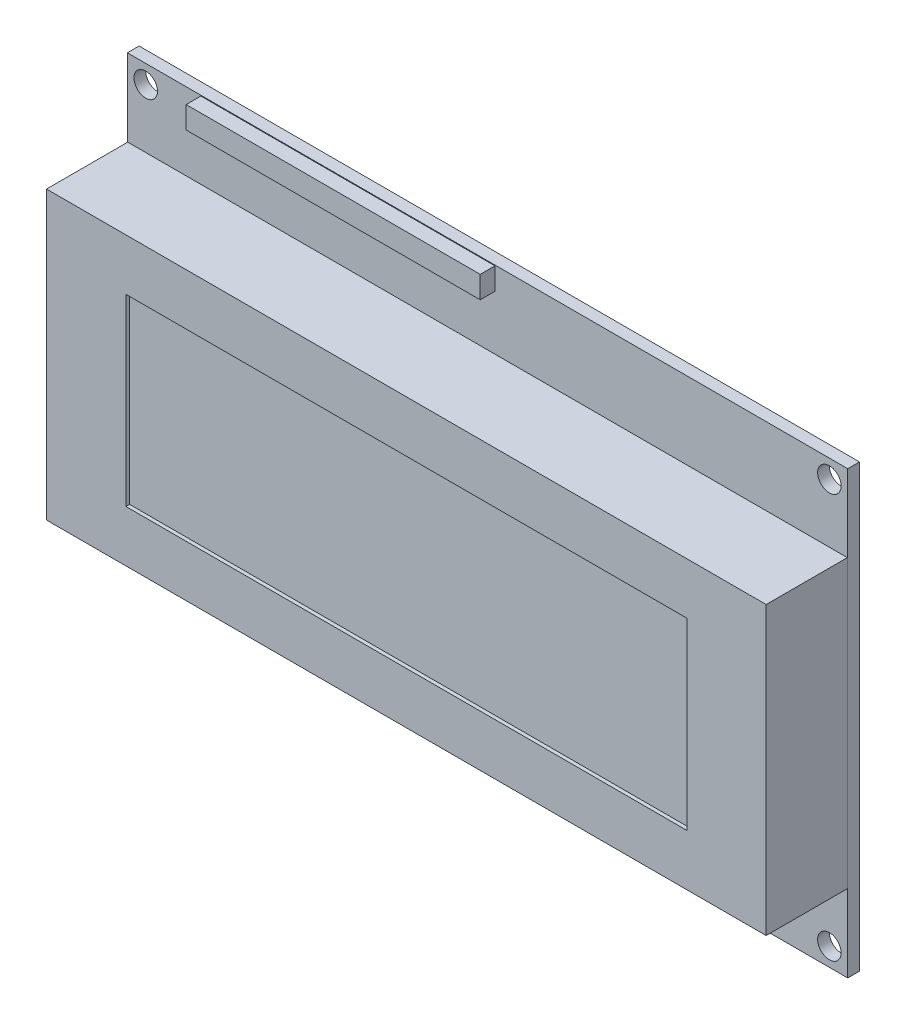
from build123d import *

# Parameters (mm, degrees)
ESQUISSE1_W             = 98
ESQUISSE1_H             = 60
BOSS_EXTRU_1_DEPTH      = 1.6
ESQUISSE2_R             = 1.6
ENL_V_MAT_EXTRU_1_DEPTH = 58.476603936
ESQUISSE3_W             = 97.9
ESQUISSE3_H             = 39
BOSS_EXTRU_2_DEPTH      = 11.05
ESQUISSE4_W             = 76.3
ESQUISSE4_H             = 25
ENL_V_MAT_EXTRU_2_DEPTH = 0.5
ESQUISSE5_W             = 40
ESQUISSE5_H             = 3
BOSS_EXTRU_3_DEPTH      = 2


with BuildPart() as part:
    # Esquisse1 → Boss.-Extru.1 (new body)
    with BuildSketch(Plane.XY):
        Rectangle(ESQUISSE1_W, ESQUISSE1_H)
    extrude(amount=BOSS_EXTRU_1_DEPTH)

    # Esquisse2 → Enlèv. mat.-Extru.1 (cut, through all)
    with BuildSketch(Plane.XY.offset(1.6)):
        with Locations((-46.5, 27.5)):
            Circle(ESQUISSE2_R)
        with Locations((-46.5, -27.5)):
            Circle(ESQUISSE2_R)
        with Locations((46.5, -27.5)):
            Circle(ESQUISSE2_R)
        with Locations((46.5, 27.5)):
            Circle(ESQUISSE2_R)
    extrude(amount=-ENL_V_MAT_EXTRU_1_DEPTH, mode=Mode.SUBTRACT)

    # Esquisse3 → Boss.-Extru.2 (add)
    with BuildSketch(Plane.XY.offset(1.6)):
        Rectangle(ESQUISSE3_W, ESQUISSE3_H)
    extrude(amount=BOSS_EXTRU_2_DEPTH)

    # Esquisse4 → Enlèv. mat.-Extru.2 (cut)
    with BuildSketch(Plane.XY.offset(12.65)):
        Rectangle(ESQUISSE4_W, ESQUISSE4_H)
    extrude(amount=-ENL_V_MAT_EXTRU_2_DEPTH, mode=Mode.SUBTRACT)

    # Esquisse5 → Boss.-Extru.3 (add)
    with BuildSketch(Plane.XY.offset(1.6)):
        with Locations((-19, 28.4)):
            Rectangle(ESQUISSE5_W, ESQUISSE5_H)
    extrude(amount=BOSS_EXTRU_3_DEPTH)


solid = part.part
